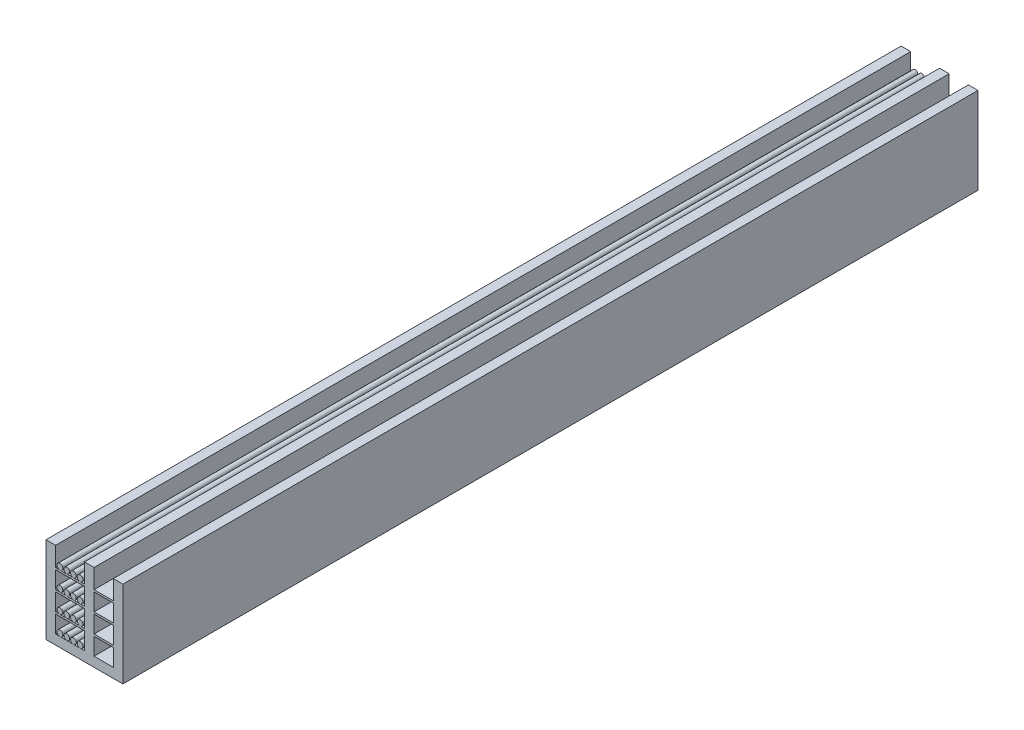
from build123d import *

# Parameters (mm, degrees)
SALIENTE_EXTRUIR1_DEPTH   = 8900
CROQUIS2_W                = 100
CROQUIS2_H                = 130
SALIENTE_EXTRUIR2_DEPTH   = 8900
CROQUIS3_W                = 100
CROQUIS3_H                = 300
SALIENTE_EXTRUIR3_DEPTH   = 8900
SALIENTE_EXTRUIR4_REACH   = 8983.091
CROQUIS4_W                = 8900
CROQUIS4_H                = 20
CROQUIS6_R                = 30
SALIENTE_EXTRUIR5_DEPTH   = 8900
SALIENTE_EXTRUIR5_2_DEPTH = 8900
SALIENTE_EXTRUIR5_3_DEPTH = 8900
SALIENTE_EXTRUIR5_4_DEPTH = 8900
MATRIZL1_COUNT            = 4
MATRIZL1_PITCH            = 200


with BuildPart() as part:
    # Croquis1 → Saliente-Extruir1 (new body)
    with BuildSketch(Plane.XY):
        Polygon((0, 0), (-800, 0), (-800, 600), (-700, 600), (-700, 100), (-400, 100), (-400, 470), (-300, 470), (-300, 100), (-100, 100), (-100, 600), (0, 600), align=None)
    extrude(amount=SALIENTE_EXTRUIR1_DEPTH)

    # Croquis2 → Saliente-Extruir2 (add)
    with BuildSketch(Plane(origin=(0, 0, 0), x_dir=(-1, 0, 0), z_dir=(0, 0, -1))):
        with Locations((350, 535)):
            Rectangle(CROQUIS2_W, CROQUIS2_H)
    extrude(amount=-SALIENTE_EXTRUIR2_DEPTH)

    # Croquis3 → Saliente-Extruir3 (add)
    with BuildSketch(Plane(origin=(0, 0, 0), x_dir=(-1, 0, 0), z_dir=(0, 0, -1))):
        with Locations((50, 750)):
            Rectangle(CROQUIS3_W, CROQUIS3_H)
        with Locations((350, 750)):
            Rectangle(CROQUIS3_W, CROQUIS3_H)
        with Locations((750, 750)):
            Rectangle(CROQUIS3_W, CROQUIS3_H)
    extrude(amount=-SALIENTE_EXTRUIR3_DEPTH)

    # Saliente-Extruir4: up to this face of the body (flat: up to its plane)
    saliente_extruir4_end = Plane(part.part.faces().sort_by_distance((-100, 500, 4450))[0])
    # Croquis4 → Saliente-Extruir4 (add, up to the picked face)
    with BuildSketch(Plane.ZY.offset(800), mode=Mode.PRIVATE) as saliente_extruir4_sk1:
        with Locations((4450, 290)):
            Rectangle(CROQUIS4_W, CROQUIS4_H)
    saliente_extruir4_tool1 = split(extrude(saliente_extruir4_sk1.sketch, amount=-SALIENTE_EXTRUIR4_REACH, mode=Mode.PRIVATE), bisect_by=saliente_extruir4_end, keep=Keep.BOTH, mode=Mode.PRIVATE)
    # Croquis4 → Saliente-Extruir4 (add, up to the picked face)
    with BuildSketch(Plane.ZY.offset(800), mode=Mode.PRIVATE) as saliente_extruir4_sk2:
        with Locations((4450, 490)):
            Rectangle(CROQUIS4_W, CROQUIS4_H)
    saliente_extruir4_tool2 = split(extrude(saliente_extruir4_sk2.sketch, amount=-SALIENTE_EXTRUIR4_REACH, mode=Mode.PRIVATE), bisect_by=saliente_extruir4_end, keep=Keep.BOTH, mode=Mode.PRIVATE)
    # Croquis4 → Saliente-Extruir4 (add, up to the picked face)
    with BuildSketch(Plane.ZY.offset(800), mode=Mode.PRIVATE) as saliente_extruir4_sk3:
        with Locations((4450, 690)):
            Rectangle(CROQUIS4_W, CROQUIS4_H)
    saliente_extruir4_tool3 = split(extrude(saliente_extruir4_sk3.sketch, amount=-SALIENTE_EXTRUIR4_REACH, mode=Mode.PRIVATE), bisect_by=saliente_extruir4_end, keep=Keep.BOTH, mode=Mode.PRIVATE)
    add(saliente_extruir4_tool1.solids().sort_by(Axis((-800, 290, 4450), (1, 0, 0)))[0])
    add(saliente_extruir4_tool2.solids().sort_by(Axis((-800, 490, 4450), (1, 0, 0)))[0])
    add(saliente_extruir4_tool3.solids().sort_by(Axis((-800, 690, 4450), (1, 0, 0)))[0])


with BuildPart() as body_2:
    # Croquis6 → Saliente-Extruir5 (new body)
    with BuildSketch(Plane(origin=(0, 0, 0), x_dir=(-1, 0, 0), z_dir=(0, 0, -1))):
        with Locations((445, 130)):
            Circle(CROQUIS6_R)
    saliente_extruir5 = extrude(amount=-SALIENTE_EXTRUIR5_DEPTH)


with BuildPart() as body_3:
    # Croquis6 → Saliente-Extruir5 2 (new body)
    with BuildSketch(Plane(origin=(0, 0, 0), x_dir=(-1, 0, 0), z_dir=(0, 0, -1))):
        with Locations((515, 130)):
            Circle(CROQUIS6_R)
    saliente_extruir5_2 = extrude(amount=-SALIENTE_EXTRUIR5_2_DEPTH)


with BuildPart() as body_4:
    # Croquis6 → Saliente-Extruir5 3 (new body)
    with BuildSketch(Plane(origin=(0, 0, 0), x_dir=(-1, 0, 0), z_dir=(0, 0, -1))):
        with Locations((585, 130)):
            Circle(CROQUIS6_R)
    saliente_extruir5_3 = extrude(amount=-SALIENTE_EXTRUIR5_3_DEPTH)


with BuildPart() as body_5:
    # Croquis6 → Saliente-Extruir5 4 (new body)
    with BuildSketch(Plane(origin=(0, 0, 0), x_dir=(-1, 0, 0), z_dir=(0, 0, -1))):
        with Locations((655, 130)):
            Circle(CROQUIS6_R)
    saliente_extruir5_4 = extrude(amount=-SALIENTE_EXTRUIR5_4_DEPTH)


with BuildPart() as matrizl1_1:
    # MatrizL1: Saliente-Extruir5, Saliente-Extruir5 2, Saliente-Extruir5 3, Saliente-Extruir5 4 ×4
    with Locations(*[(0, i * MATRIZL1_PITCH, 0) for i in range(1, MATRIZL1_COUNT)]):
        add(saliente_extruir5)
        add(saliente_extruir5_2)
        add(saliente_extruir5_3)
        add(saliente_extruir5_4)


solid = Compound([part.part, body_2.part, body_3.part, body_4.part, body_5.part, matrizl1_1.part])
